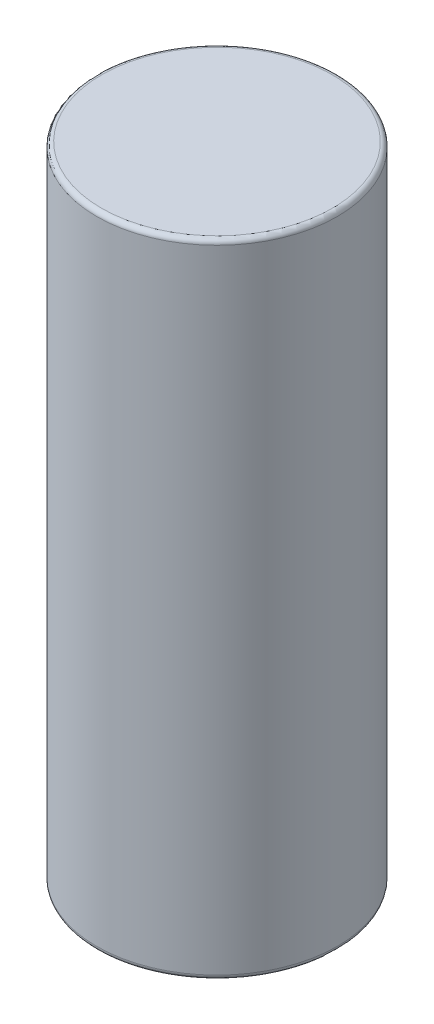
from build123d import *

# Parameters (mm, degrees)
SKETCH1_W = 75
SKETCH1_H = 400
FILLET1_R = 3


with BuildPart() as part:
    # Sketch1 → Revolve1 (revolve)
    with BuildSketch(Plane.XY, mode=Mode.PRIVATE) as revolve1_sk:
        with Locations((37.5, 0)):
            Rectangle(SKETCH1_W, SKETCH1_H)
    revolve(revolve1_sk.sketch.rotate(Axis((0, 0, 0), (0, 1, 0)), 90), axis=Axis((0, 0, 0), (0, 1, 0)))

    # Fillet1
    fillet1_edges = [part.edges().sort_by_distance(p)[0] for p in [
        (0, 200, 75),
        (0, -200, 75),
    ]]
    fillet(fillet1_edges, radius=FILLET1_R)


solid = part.part
